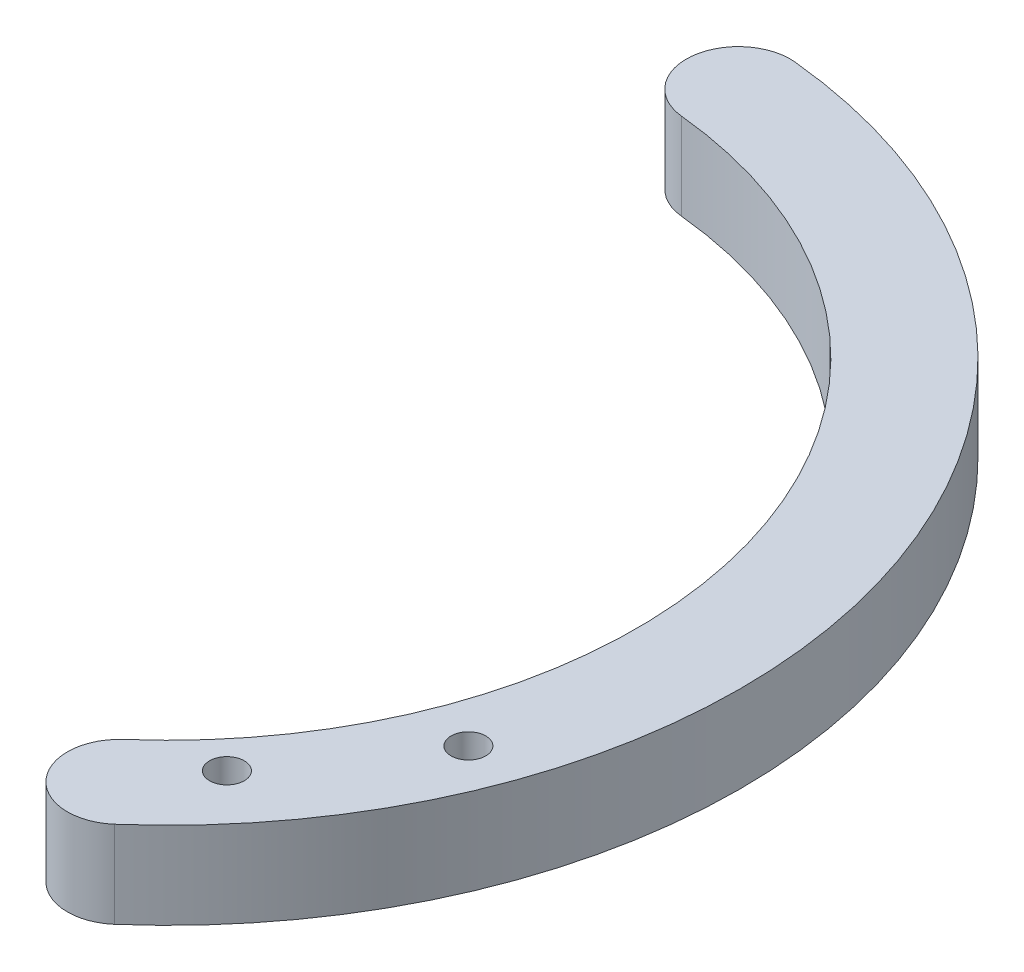
from build123d import *

# Parameters (mm, degrees)
SKETCH1_R           = 1
BOSS_EXTRUDE1_DEPTH = 5


with BuildPart() as part:
    # Sketch1 → Boss-Extrude1 (new body)
    with BuildSketch(Plane(origin=(0, 0, 0), x_dir=(1, 0, 0), z_dir=(0, 1, 0))):
        with BuildLine():
            ThreePointArc((21.725, -24.839975342), (31.434875475, 10.042340556), (3.3, 32.834585425))
            ThreePointArc((3.3, 32.834585425), (0.015037689, 30.149623113), (2.7, 26.864660802))
            ThreePointArc((2.7, 26.864660802), (25.719443571, 8.216460455), (17.775, -20.323616189))
            ThreePointArc((17.775, -20.323616189), (17.491820423, -24.556795766), (21.725, -24.839975342))
        make_face()
        with Locations(Location((22.295500251, -18.931737071, 0), (0, 0, 270))):
            Circle(SKETCH1_R, mode=Mode.SUBTRACT)
        with Locations(Location((28.015725535, -10.729357984, 0), (0, 0, 270))):
            Circle(SKETCH1_R, mode=Mode.SUBTRACT)
    extrude(amount=BOSS_EXTRUDE1_DEPTH)


solid = part.part
